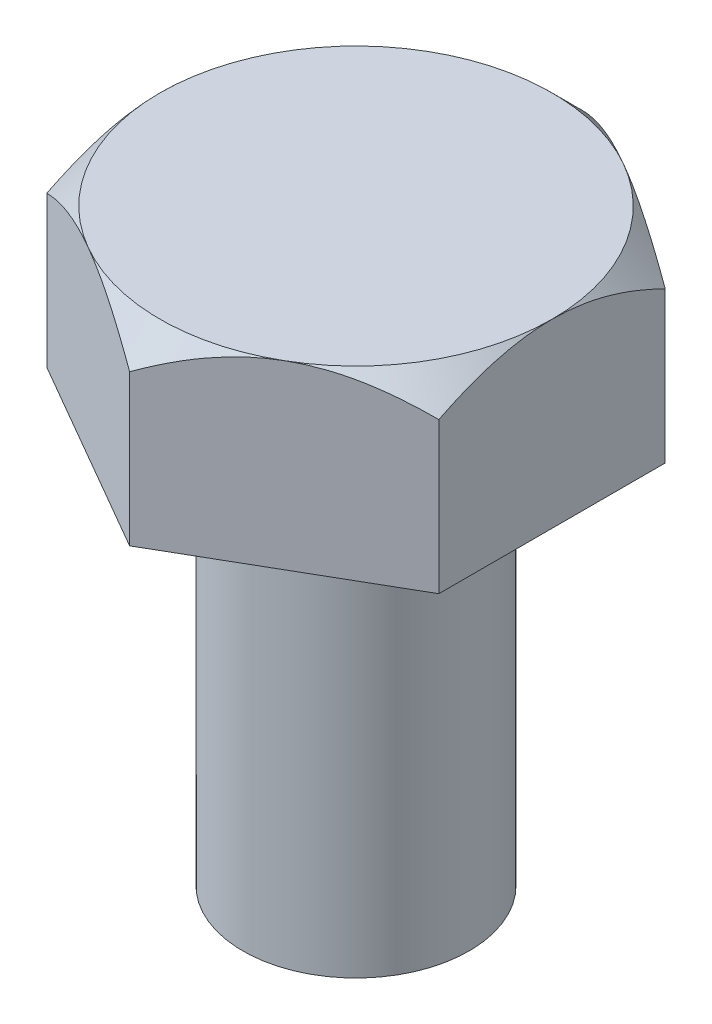
from build123d import *

# Parameters (mm, degrees)
BOSS_EXTRUDE1_DEPTH = 4
SKETCH2_R           = 2.5
BOSS_EXTRUDE2_DEPTH = 9
SKETCH3_OUTSIDE_W   = 32.37
SKETCH3_OUTSIDE_H   = 33.71
SKETCH3_OUTSIDE_R   = 4.330127019
CUT_EXTRUDE1_DEPTH  = 9
CUT_EXTRUDE1_DRAFT  = -45


with BuildPart() as part:
    # Sketch1 → Boss-Extrude1 (new body)
    with BuildSketch(Plane(origin=(0, 0, 0), x_dir=(1, 0, 0), z_dir=(0, 1, 0))):
        Polygon((0, -5), (4.330127019, -2.5), (4.330127019, 2.5), (0, 5), (-4.330127019, 2.5), (-4.330127019, -2.5), align=None)
    extrude(amount=BOSS_EXTRUDE1_DEPTH)

    # Sketch2 → Boss-Extrude2 (add)
    with BuildSketch(Plane.XZ):
        with Locations(Location((0, 0, 0), (0, 0, 270))):
            Circle(SKETCH2_R)
    extrude(amount=BOSS_EXTRUDE2_DEPTH)


with BuildPart() as cut_extrude1_tool:
    # Sketch3 outside → Cut-Extrude1 (with draft: the straight prism first)
    with BuildSketch(Plane(origin=(0, 4, 0), x_dir=(1, 0, 0), z_dir=(0, 1, 0))):
        Rectangle(SKETCH3_OUTSIDE_W, SKETCH3_OUTSIDE_H)
        Circle(SKETCH3_OUTSIDE_R, mode=Mode.SUBTRACT)
    extrude(amount=-CUT_EXTRUDE1_DEPTH)
    # Cut-Extrude1: the draft: its side faces are tilted about the plane it starts from
    cut_extrude1_sides = [cut_extrude1_tool.faces().sort_by_distance(p)[0] for p in [
        (0, -0.5, 16.855),
        (16.185, -0.5, 0),
        (0, -0.5, -16.855),
        (-16.185, -0.5, 0),
        (-4.330127019, -0.5, 0),
    ]]
    draft(cut_extrude1_sides, Plane(origin=(0, 4, 0), x_dir=(1, 0, 0), z_dir=(0, 1, 0)), CUT_EXTRUDE1_DRAFT)


with BuildPart() as part_1:
    add(part.part)

    # Cut-Extrude1: cut by cut_extrude1_tool
    add(cut_extrude1_tool.part, mode=Mode.SUBTRACT)


solid = part_1.part
